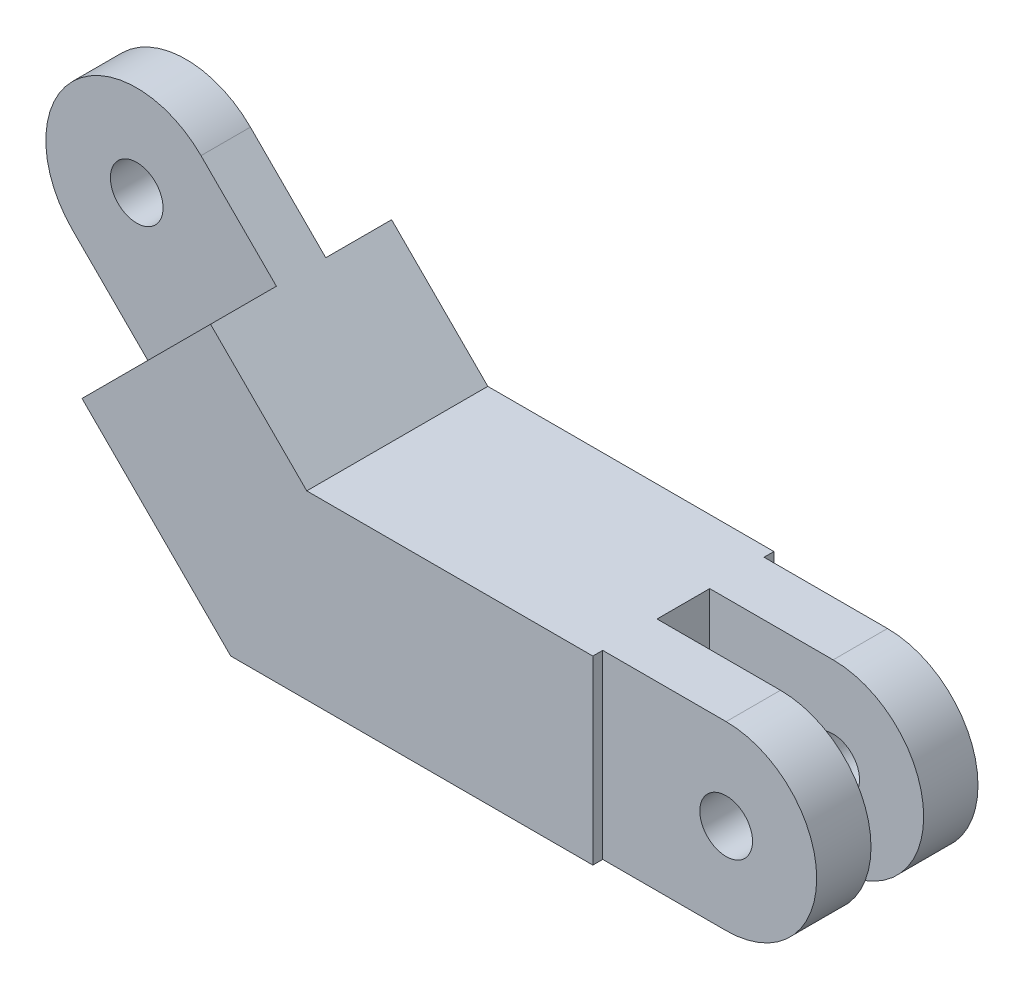
from build123d import *

# Parameters (mm, degrees)
SALIENTE_EXTRUIR1_DEPTH = 11
CROQUIS13_W             = 3
CROQUIS13_H             = 12
SALIENTE_EXTRUIR3_DEPTH = 11.044424957
CROQUIS15_W             = 13
CROQUIS15_H             = 3.3
SALIENTE_EXTRUIR5_DEPTH = 11
REDONDEO1_RADIUS        = 5.522212479
REDONDEO1_LENGTH        = 3
REDONDEO2_RADIUS        = 5.5
REDONDEO2_LENGTH        = 3.3
REDONDEO3_RADIUS        = 5.5
REDONDEO3_LENGTH        = 3.3
CROQUIS16_R             = 1.6
CORTAR_EXTRUIR6_DEPTH   = 54.876956991
CROQUIS17_R             = 1.6
CORTAR_EXTRUIR7_DEPTH   = 55.423216504


with BuildPart() as part:
    # Croquis2 → Saliente-Extruir1 (new body)
    with BuildSketch(Plane.XY):
        Polygon((-7.377824178, -34.958999634), (10.003000259, -34.958999634), (10.003000259, -45.958999634), (-11.996999741, -45.958999634), (-21.032533647, -36.923465728), (-13.222945865, -29.113877947), align=None)
    extrude(amount=SALIENTE_EXTRUIR1_DEPTH)

    # Croquis13 → Saliente-Extruir3 (add)
    with BuildSketch(Plane(origin=(-21.168411906, -21.168411906, 0), x_dir=(0, 0, -1), z_dir=(0.7071067811865442, 0.7071067811865508, 0))):
        with Locations((-5.5, -5.236585834)):
            Rectangle(CROQUIS13_W, CROQUIS13_H)
    extrude(amount=-SALIENTE_EXTRUIR3_DEPTH)

    # Croquis15 → Saliente-Extruir5 (add, through all)
    with BuildSketch(Plane(origin=(0, -34.958999634, 0), x_dir=(1, 0, 0), z_dir=(0, 1, 0))):
        with Locations((16.503000259, -2.25)):
            Rectangle(CROQUIS15_W, CROQUIS15_H)
        with Locations((16.503000259, -8.75)):
            Rectangle(CROQUIS15_W, CROQUIS15_H)
    extrude(amount=-SALIENTE_EXTRUIR5_DEPTH)

    # Redondeo1: full round fillet: the end face becomes a half cylinder, R = half its width
    redondeo1_face = Plane((-25.61302113, -24.533390463, 5.5), x_dir=(0, 0, -1), z_dir=(-0.707106781187, 0.707106781187, 0))  # on the end face: x along it, z out of the body
    redondeo1_slab = redondeo1_face.offset(-REDONDEO1_RADIUS / 2) * Box(REDONDEO1_LENGTH, 2 * REDONDEO1_RADIUS, REDONDEO1_RADIUS, mode=Mode.PRIVATE)  # the body's end, R deep
    redondeo1_round = Plane((-21.708227239, -28.438184354, 5.5), x_dir=(-0.707106781187, 0.707106781187, 0), z_dir=(0, 0, -1)) * Cylinder(REDONDEO1_RADIUS, REDONDEO1_LENGTH, mode=Mode.PRIVATE)  # its axis R under the face
    add(redondeo1_slab - redondeo1_round, mode=Mode.SUBTRACT)

    # Redondeo2: full round fillet: the end face becomes a half cylinder, R = half its width
    redondeo2_face = Plane((23.003000259, -40.458999634, 8.75), x_dir=(0, 0, -1), z_dir=(1, 0, 0))  # on the end face: x along it, z out of the body
    redondeo2_slab = redondeo2_face.offset(-REDONDEO2_RADIUS / 2) * Box(REDONDEO2_LENGTH, 2 * REDONDEO2_RADIUS, REDONDEO2_RADIUS, mode=Mode.PRIVATE)  # the body's end, R deep
    redondeo2_round = Plane((17.503000259, -40.458999634, 8.75), x_dir=(1, 0, 0), z_dir=(0, 0, -1)) * Cylinder(REDONDEO2_RADIUS, REDONDEO2_LENGTH, mode=Mode.PRIVATE)  # its axis R under the face
    add(redondeo2_slab - redondeo2_round, mode=Mode.SUBTRACT)

    # Redondeo3: full round fillet: the end face becomes a half cylinder, R = half its width
    redondeo3_face = Plane((23.003000259, -40.458999634, 2.25), x_dir=(0, 0, -1), z_dir=(1, 0, 0))  # on the end face: x along it, z out of the body
    redondeo3_slab = redondeo3_face.offset(-REDONDEO3_RADIUS / 2) * Box(REDONDEO3_LENGTH, 2 * REDONDEO3_RADIUS, REDONDEO3_RADIUS, mode=Mode.PRIVATE)  # the body's end, R deep
    redondeo3_round = Plane((17.503000259, -40.458999634, 2.25), x_dir=(1, 0, 0), z_dir=(0, 0, -1)) * Cylinder(REDONDEO3_RADIUS, REDONDEO3_LENGTH, mode=Mode.PRIVATE)  # its axis R under the face
    add(redondeo3_slab - redondeo3_round, mode=Mode.SUBTRACT)

    # Croquis16 → Cortar-Extruir6 (cut, through all)
    with BuildSketch(Plane(origin=(0, 0, 4), x_dir=(-1, 0, 0), z_dir=(0, 0, -1))):
        with Locations((21.70822724, -28.438184354)):
            Circle(CROQUIS16_R)
    extrude(amount=-CORTAR_EXTRUIR6_DEPTH, mode=Mode.SUBTRACT)

    # Croquis17 → Cortar-Extruir7 (cut, through all)
    with BuildSketch(Plane(origin=(0, 0, 0.6), x_dir=(-1, 0, 0), z_dir=(0, 0, -1))):
        with Locations((-17.503000259, -40.458999634)):
            Circle(CROQUIS17_R)
    extrude(amount=-CORTAR_EXTRUIR7_DEPTH, mode=Mode.SUBTRACT)


solid = part.part
